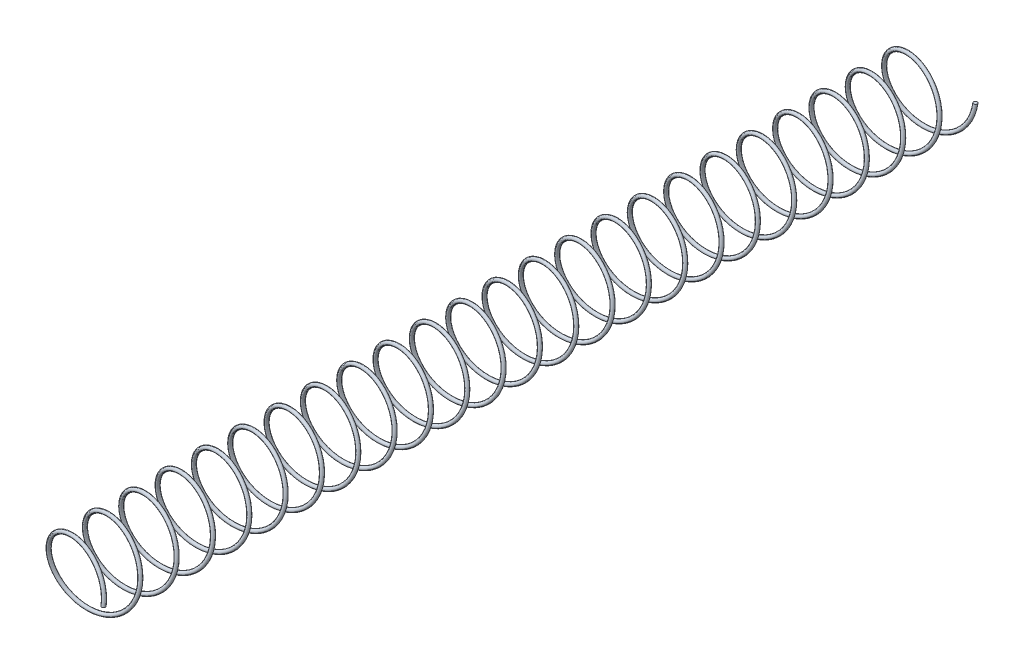
from build123d import *

# Parameters (mm, degrees)
SWEEP1_PITCH  = 25.4
SWEEP1_HEIGHT = 609.6
SWEEP1_RADIUS = 25.4
SKETCH3_R     = 1.2954


with BuildPart() as part:
    # Sweep1: sweep along a helix
    with BuildLine() as sweep1_path:
        Helix(SWEEP1_PITCH, SWEEP1_HEIGHT, SWEEP1_RADIUS, center=(0, 0, 0), direction=(0, 0, 1), lefthand=True)
    # Sketch3 → Sweep1 (sweep)
    with BuildSketch(Plane(origin=(0, 0, 0), x_dir=(1, 0, 0), z_dir=(0, 1, 0))):
        with Locations((25.4, 0)):
            Circle(SKETCH3_R)
    sweep(path=sweep1_path.line, is_frenet=True)


solid = part.part
